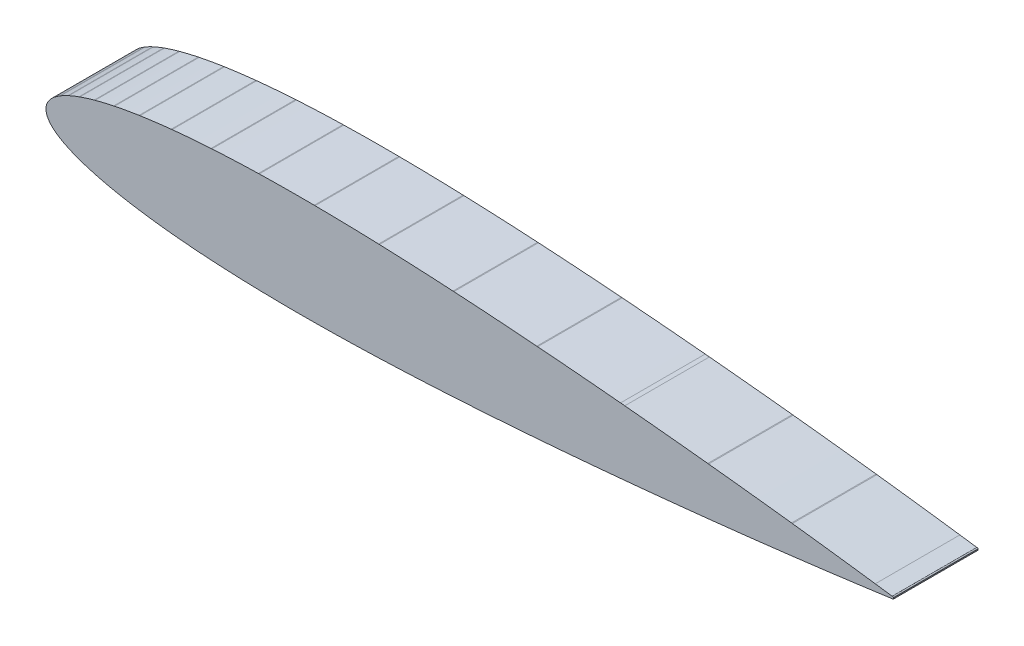
from build123d import *

# Parameters (mm, degrees)
BOSS_EXTRUDE1_DEPTH = 2.54


with BuildPart() as part:
    # Model → Boss-Extrude1 (new body)
    with BuildSketch(Plane.XY):
        with BuildLine():
            Line((0.837402515, 4.194701871), (0.812002515, 4.238232391))
            ThreePointArc((0.812002515, 4.238232391), (0.774103936, 4.334279035), (0.761202515, 4.436723231))
            ThreePointArc((0.761202515, 4.436723231), (0.774103936, 4.539167428), (0.812002515, 4.635214071))
            Line((0.812002515, 4.635214071), (0.837402515, 4.678744591))
            Line((0.837402515, 4.678744591), (0.862802515, 4.715127551))
            Line((0.862802515, 4.715127551), (0.888202515, 4.746935971))
            Line((0.888202515, 4.746935971), (0.913602515, 4.775495731))
            Line((0.913602515, 4.775495731), (0.939002515, 4.801589151))
            Line((0.939002515, 4.801589151), (0.964402515, 4.825726771))
            Line((0.964402515, 4.825726771), (0.989802515, 4.848266731))
            Line((0.989802515, 4.848266731), (1.015202515, 4.869465571))
            ThreePointArc((1.015202515, 4.869465571), (1.089772897, 4.925535764), (1.167602515, 4.976986311))
            Line((1.167602515, 4.976986311), (1.193002515, 4.992508251))
            ThreePointArc((1.193002515, 4.992508251), (1.305754767, 5.055617229), (1.421602515, 5.112845831))
            Line((1.421602515, 5.112845831), (1.447002515, 5.124547611))
            ThreePointArc((1.447002515, 5.124547611), (1.598149319, 5.189132356), (1.751802515, 5.247503931))
            Line((1.751802515, 5.247503931), (1.777202515, 5.256564111))
            ThreePointArc((1.777202515, 5.256564111), (1.991913899, 5.32756087), (2.209002515, 5.390917411))
            Line((2.209002515, 5.390917411), (2.234402515, 5.397856691))
            ThreePointArc((2.234402515, 5.397856691), (2.512823075, 5.468426298), (2.793202515, 5.530759651))
            Line((2.793202515, 5.530759651), (2.818602515, 5.536032691))
            ThreePointArc((2.818602515, 5.536032691), (3.18604982, 5.606262809), (3.555202515, 5.666893491))
            Line((3.555202515, 5.666893491), (3.580602515, 5.670744131))
            ThreePointArc((3.580602515, 5.670744131), (4.049820252, 5.735370933), (4.520402515, 5.789169091))
            Line((4.520402515, 5.789169091), (4.545802515, 5.791795451))
            ThreePointArc((4.545802515, 5.791795451), (5.129518216, 5.845119064), (5.714202515, 5.886491731))
            Line((5.714202515, 5.886491731), (5.739602515, 5.888043671))
            ThreePointArc((5.739602515, 5.888043671), (6.437840457, 5.923508303), (7.136602515, 5.946433191))
            Line((7.136602515, 5.946433191), (7.162002515, 5.947052951))
            ThreePointArc((7.162002515, 5.947052951), (7.987453434, 5.959786425), (8.813002515, 5.959509111))
            Line((8.813002515, 5.959509111), (8.838402515, 5.959313531))
            ThreePointArc((8.838402515, 5.959313531), (9.791045496, 5.944671622), (10.743402515, 5.917119051))
            Line((10.743402515, 5.917119051), (10.768802515, 5.916224971))
            ThreePointArc((10.768802515, 5.916224971), (11.874009843, 5.869976991), (12.978602515, 5.810840371))
            Line((12.978602515, 5.810840371), (13.004002515, 5.809341771))
            ThreePointArc((13.004002515, 5.809341771), (14.249024434, 5.729100435), (15.493202515, 5.636692891))
            Line((15.493202515, 5.636692891), (15.518602515, 5.634691371))
            ThreePointArc((15.518602515, 5.634691371), (16.763614783, 5.531321058), (18.007802486, 5.418458634))
            Line((18.007802486, 5.418458634), (18.134802481, 5.406436814))
            ThreePointArc((18.134802481, 5.406436814), (19.379819615, 5.283861478), (20.624002515, 5.153089591))
            Line((20.624002515, 5.153089591), (20.649402515, 5.150333691))
            ThreePointArc((20.649402515, 5.150333691), (21.894471689, 5.011181274), (23.138602515, 4.863875031))
            Line((23.138602515, 4.863875031), (23.164002515, 4.860781311))
            ThreePointArc((23.164002515, 4.860781311), (24.409193854, 4.704533833), (25.653202485, 4.539133495))
            Line((25.653202485, 4.539133495), (26.161202515, 4.468727231))
            ThreePointArc((26.161202515, 4.468727231), (26.191266445, 4.466787161), (26.189326375, 4.436723231))
            ThreePointArc((26.189326375, 4.436723231), (26.191266445, 4.406659301), (26.161202515, 4.404719231))
            Line((26.161202515, 4.404719231), (25.653202485, 4.334312967))
            ThreePointArc((25.653202485, 4.334312967), (24.409193854, 4.168912629), (23.164002515, 4.012665151))
            Line((23.164002515, 4.012665151), (23.138602515, 4.009571431))
            ThreePointArc((23.138602515, 4.009571431), (21.894471689, 3.862265188), (20.649402515, 3.723112771))
            Line((20.649402515, 3.723112771), (20.624002515, 3.720356871))
            ThreePointArc((20.624002515, 3.720356871), (19.379819615, 3.589584984), (18.134802481, 3.467009648))
            Line((18.134802481, 3.467009648), (18.007802486, 3.454987828))
            ThreePointArc((18.007802486, 3.454987828), (16.763614783, 3.342125404), (15.518602515, 3.238755091))
            Line((15.518602515, 3.238755091), (15.493202515, 3.236753571))
            ThreePointArc((15.493202515, 3.236753571), (14.249024434, 3.144346027), (13.004002515, 3.064104691))
            Line((13.004002515, 3.064104691), (12.978602515, 3.062606091))
            ThreePointArc((12.978602515, 3.062606091), (11.874009843, 3.003469471), (10.768802515, 2.957221491))
            Line((10.768802515, 2.957221491), (10.743402515, 2.956327411))
            ThreePointArc((10.743402515, 2.956327411), (9.791045496, 2.92877484), (8.838402515, 2.914132931))
            Line((8.838402515, 2.914132931), (8.813002515, 2.913937351))
            ThreePointArc((8.813002515, 2.913937351), (7.987453434, 2.913660037), (7.162002515, 2.926393511))
            Line((7.162002515, 2.926393511), (7.136602515, 2.927013271))
            ThreePointArc((7.136602515, 2.927013271), (6.437840457, 2.949938159), (5.739602515, 2.985402791))
            Line((5.739602515, 2.985402791), (5.714202515, 2.986954731))
            ThreePointArc((5.714202515, 2.986954731), (5.129518216, 3.028327398), (4.545802515, 3.081651011))
            Line((4.545802515, 3.081651011), (4.520402515, 3.084277371))
            ThreePointArc((4.520402515, 3.084277371), (4.049820252, 3.138075529), (3.580602515, 3.202702331))
            Line((3.580602515, 3.202702331), (3.555202515, 3.206552971))
            ThreePointArc((3.555202515, 3.206552971), (3.18604982, 3.267183653), (2.818602515, 3.337413771))
            Line((2.818602515, 3.337413771), (2.793202515, 3.342686811))
            ThreePointArc((2.793202515, 3.342686811), (2.512823075, 3.405020164), (2.234402515, 3.475589771))
            Line((2.234402515, 3.475589771), (2.209002515, 3.482529051))
            ThreePointArc((2.209002515, 3.482529051), (1.991913899, 3.545885592), (1.777202515, 3.616882351))
            Line((1.777202515, 3.616882351), (1.751802515, 3.625942531))
            ThreePointArc((1.751802515, 3.625942531), (1.598149319, 3.684314106), (1.447002515, 3.748898851))
            Line((1.447002515, 3.748898851), (1.421602515, 3.760600631))
            ThreePointArc((1.421602515, 3.760600631), (1.305754767, 3.817829233), (1.193002515, 3.880938211))
            Line((1.193002515, 3.880938211), (1.167602515, 3.896460151))
            ThreePointArc((1.167602515, 3.896460151), (1.089772897, 3.947910699), (1.015202515, 4.003980891))
            Line((1.015202515, 4.003980891), (0.989802515, 4.025179731))
            Line((0.989802515, 4.025179731), (0.964402515, 4.047719691))
            Line((0.964402515, 4.047719691), (0.939002515, 4.071857311))
            Line((0.939002515, 4.071857311), (0.913602515, 4.097950731))
            Line((0.913602515, 4.097950731), (0.888202515, 4.126510491))
            Line((0.888202515, 4.126510491), (0.862802515, 4.158318911))
            Line((0.862802515, 4.158318911), (0.837402515, 4.194701871))
        make_face()
    extrude(amount=BOSS_EXTRUDE1_DEPTH)


solid = part.part
